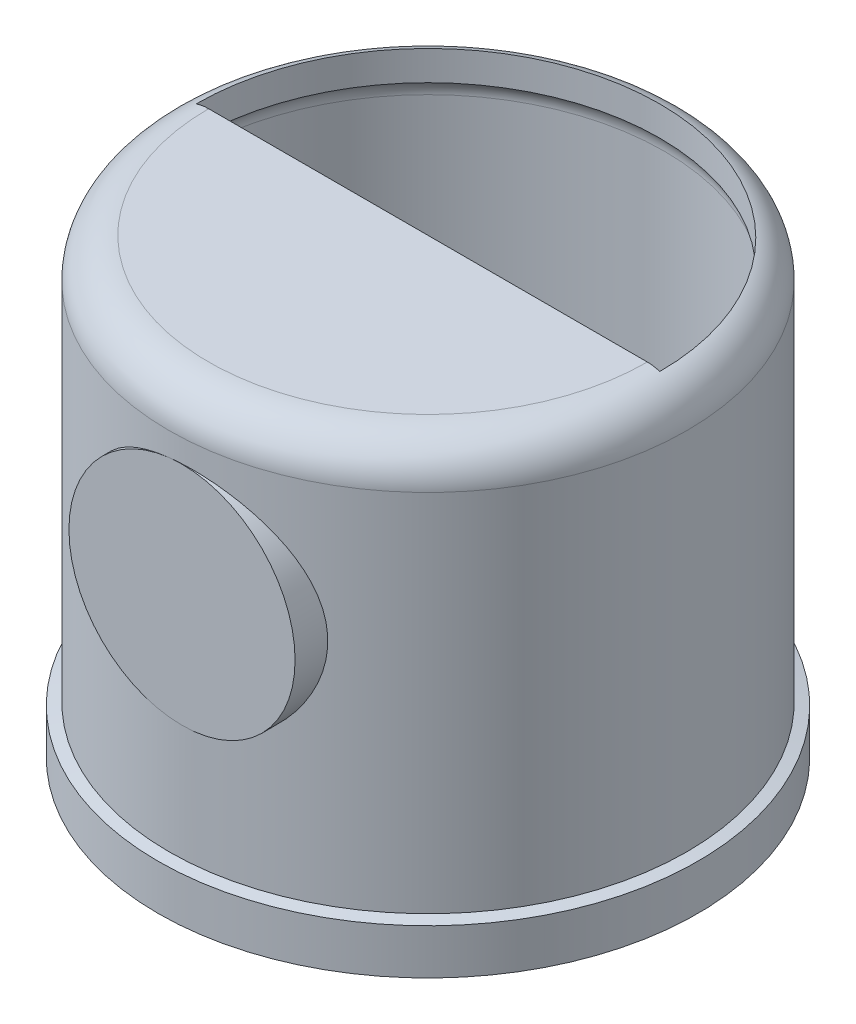
from build123d import *

# Parameters (mm, degrees)
SKETCH4_R           = 10
BOSS_EXTRUDE2_DEPTH = 6
CUT_EXTRUDE2_DEPTH  = 30


with BuildPart() as part:
    # Sketch1 → Revolve1 (revolve)
    with BuildSketch(Plane.XY, mode=Mode.PRIVATE) as revolve1_sk:
        with BuildLine():
            Line((20.9, 0), (23.871591838, 0))
            Line((23.871591838, 0), (23.871591838, 4))
            Line((23.871591838, 4), (22.9, 4.236662843))
            Line((22.9, 4.236662843), (22.9, 36.5))
            ThreePointArc((22.9, 36.5), (21.874873734, 38.974873734), (19.4, 40))
            Line((19.4, 40), (0, 40))
            Line((0, 40), (0, 38))
            Line((0, 38), (18.9, 38))
            ThreePointArc((18.9, 38), (20.314213562, 37.414213562), (20.9, 36))
            Line((20.9, 36), (20.9, 13.908178136))
            Line((20.9, 13.908178136), (0, 13.908178136))
            Line((0, 13.908178136), (0, 11.908178136))
            Line((0, 11.908178136), (20.9, 11.908178136))
            Line((20.9, 11.908178136), (20.9, 0))
        make_face()
    revolve(revolve1_sk.sketch.rotate(Axis((0, -0.724089275, 0), (0, 1, 0)), 90), axis=Axis((0, -0.724089275, 0), (0, 1, 0)))

    # Sketch4 → Boss-Extrude2 (add)
    with BuildSketch(Plane.XY.offset(22.9)):
        with Locations((1.144629865, 24.5)):
            Circle(SKETCH4_R)
    extrude(amount=-BOSS_EXTRUDE2_DEPTH)

    # Sketch9 → Cut-Extrude2 (cut)
    with BuildSketch(Plane(origin=(0, 40, 0), x_dir=(1, 0, 0), z_dir=(0, 1, 0))):
        with BuildLine():
            Line((-20.5, 0), (20.5, 0))
            ThreePointArc((20.5, 0), (0, 20.5), (-20.5, 0))
        make_face()
    extrude(amount=-CUT_EXTRUDE2_DEPTH, mode=Mode.SUBTRACT)


solid = part.part
